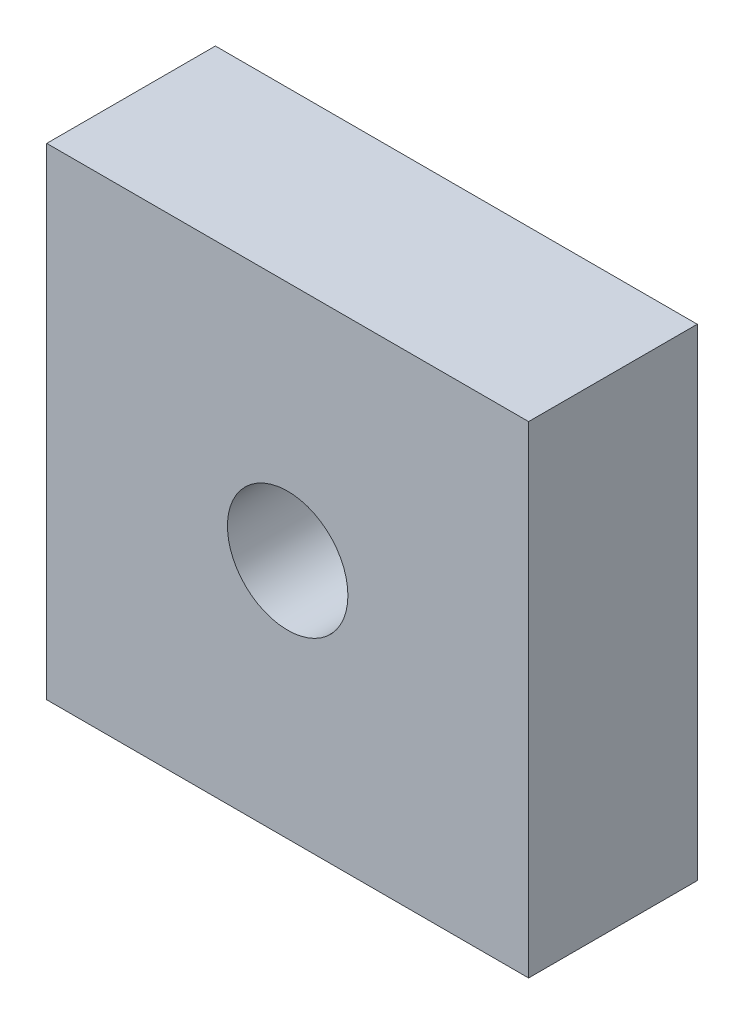
from build123d import *

# Parameters (mm, degrees)
ESBO_O1_W                = 20
ESBO_O1_H                = 20
ESBO_O1_R                = 2.5
RESSALTO_EXTRUS_O1_DEPTH = 7


with BuildPart() as part:
    # Esboço1 → Ressalto-extrusão1 (new body)
    with BuildSketch(Plane.XY):
        Rectangle(ESBO_O1_W, ESBO_O1_H)
        Circle(ESBO_O1_R, mode=Mode.SUBTRACT)
    extrude(amount=RESSALTO_EXTRUS_O1_DEPTH)


solid = part.part
